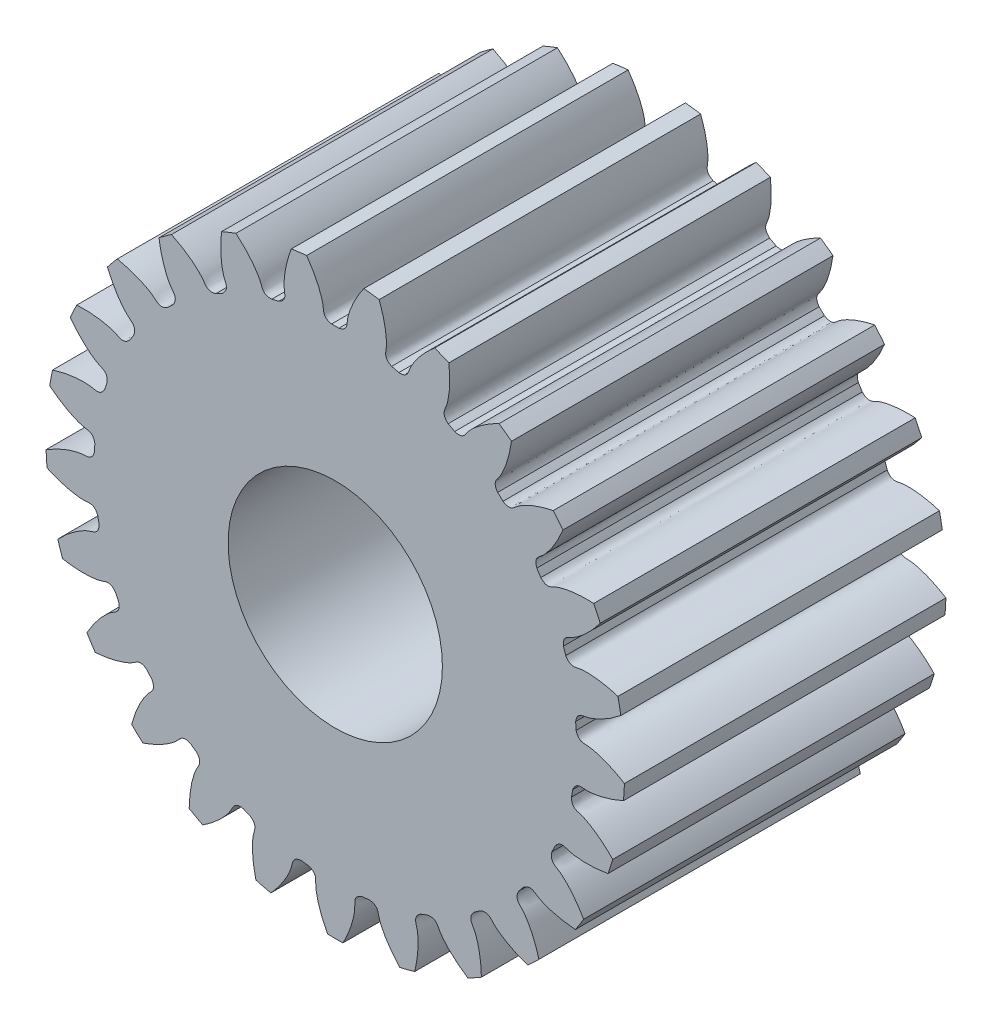
from build123d import *

# Parameters (mm, degrees)
SKETCH_1_R               = 2.7
EXTRUDE_1_DEPTH          = 3
CUT_EXTRUDE_1_DEPTH      = 5.855924217
PATTERN_CIRCULAR_1_COUNT = 25
SKETCH_4_R               = 1
CUT_EXTRUDE_2_DEPTH      = 5.854940348


with BuildPart() as part:
    # 草图1 → 凸台-拉伸1 (new body)
    with BuildSketch(Plane.XY):
        Circle(SKETCH_1_R)
    extrude(amount=EXTRUDE_1_DEPTH)

    # 草图2 → 切除-拉伸1 (cut, through all)
    with BuildSketch(Plane.XY):
        with BuildLine():
            ThreePointArc((0.034411698, 2.249736837), (0, 2.25), (-0.034411698, 2.249736837))
            add(Edge.make_bspline(
                [(-0.034411698, 2.249736837), (-0.114667963, 2.267016232), (-0.107101527, 2.315452279), (-0.114839077, 2.363610551), (-0.115924254, 2.369621688), (-0.117315286, 2.376531105), (-0.119047104, 2.38432889), (-0.121156157, 2.393003716), (-0.123677986, 2.402543279), (-0.126647969, 2.412934167), (-0.130101049, 2.42416191), (-0.134071779, 2.436210983), (-0.138594271, 2.449064816), (-0.143702179, 2.462705804), (-0.149428662, 2.477115321), (-0.155806365, 2.492273733), (-0.162867386, 2.508160411), (-0.170643252, 2.524753742), (-0.179164893, 2.54203115), (-0.188462612, 2.559969104), (-0.198566067, 2.578543142), (-0.209504238, 2.59772788), (-0.221305406, 2.617497035), (-0.23399713, 2.63782344), (-0.247606219, 2.658679063), (-0.262158711, 2.680035029), (-0.277679851, 2.701861634), (-0.294194065, 2.724128372), (-0.311724944, 2.74680395), (-0.330295214, 2.769856313), (-0.349926722, 2.793252666), (-0.370640414, 2.816959495), (-0.392456312, 2.84094259), (-0.4153935, 2.865167071), (-0.439470098, 2.889597408), (-0.464703252, 2.91419745), (-0.491109111, 2.938930447), (-0.518702812, 2.963759077), (-0.547498457, 2.988645472), (-0.587994789, 3.022253255), (-0.61949331, 3.046818631), (-0.641054295, 3.062966834)],
                knots=[0, 0, 0, 0, 0.130741207, 0.13574479, 0.141658115, 0.148481183, 0.156213993, 0.164856545, 0.174408839, 0.184870876, 0.196242655, 0.208524177, 0.221715441, 0.235816447, 0.250827195, 0.266747686, 0.283577919, 0.301317894, 0.319967612, 0.339527072, 0.359996274, 0.381375219, 0.403663906, 0.426862335, 0.450970507, 0.475988421, 0.501916077, 0.528753476, 0.556500617, 0.5851575, 0.614724126, 0.645200493, 0.676586604, 0.708882456, 0.742088051, 0.776203388, 0.811228468, 0.847163289, 0.884007854, 0.92176216, 1, 1, 1, 1], degree=3))
            ThreePointArc((-0.641054295, 3.062966834), (0, 3.129331628), (0.641054295, 3.062966834))
            add(Edge.make_bspline(
                [(0.034411698, 2.249736837), (0.114667963, 2.267016232), (0.107101527, 2.315452279), (0.114839077, 2.363610551), (0.115924254, 2.369621688), (0.117315286, 2.376531105), (0.119047104, 2.38432889), (0.121156157, 2.393003716), (0.123677986, 2.402543279), (0.126647969, 2.412934167), (0.130101049, 2.42416191), (0.134071779, 2.436210983), (0.138594271, 2.449064816), (0.143702179, 2.462705804), (0.149428662, 2.477115321), (0.155806365, 2.492273733), (0.162867386, 2.508160411), (0.170643252, 2.524753742), (0.179164893, 2.54203115), (0.188462612, 2.559969104), (0.198566067, 2.578543142), (0.209504238, 2.59772788), (0.221305406, 2.617497035), (0.23399713, 2.63782344), (0.247606219, 2.658679063), (0.262158711, 2.680035029), (0.277679851, 2.701861634), (0.294194065, 2.724128372), (0.311724944, 2.74680395), (0.330295214, 2.769856313), (0.349926722, 2.793252666), (0.370640414, 2.816959495), (0.392456312, 2.84094259), (0.4153935, 2.865167071), (0.439470098, 2.889597408), (0.464703252, 2.91419745), (0.491109111, 2.938930447), (0.518702812, 2.963759077), (0.547498457, 2.988645472), (0.587994789, 3.022253255), (0.61949331, 3.046818631), (0.641054295, 3.062966834)],
                knots=[0, 0, 0, 0, 0.130741207, 0.13574479, 0.141658115, 0.148481183, 0.156213993, 0.164856545, 0.174408839, 0.184870876, 0.196242655, 0.208524177, 0.221715441, 0.235816447, 0.250827195, 0.266747686, 0.283577919, 0.301317894, 0.319967612, 0.339527072, 0.359996274, 0.381375219, 0.403663906, 0.426862335, 0.450970507, 0.475988421, 0.501916077, 0.528753476, 0.556500617, 0.5851575, 0.614724126, 0.645200493, 0.676586604, 0.708882456, 0.742088051, 0.776203388, 0.811228468, 0.847163289, 0.884007854, 0.92176216, 1, 1, 1, 1], degree=3))
        make_face()
    cut_extrude_1 = extrude(amount=CUT_EXTRUDE_1_DEPTH, mode=Mode.SUBTRACT)

    # 阵列(圆周)1: 切除-拉伸1 ×25 about axis
    pattern_circular_1_axis = Axis((0, 0, 3), (0, 0, -1))
    for i in range(1, PATTERN_CIRCULAR_1_COUNT):
        add(cut_extrude_1.rotate(pattern_circular_1_axis, i * 360 / PATTERN_CIRCULAR_1_COUNT), mode=Mode.SUBTRACT)

    # 草图4 → 切除-拉伸2 (cut, through all)
    with BuildSketch(Plane.XY):
        Circle(SKETCH_4_R)
    extrude(amount=CUT_EXTRUDE_2_DEPTH, mode=Mode.SUBTRACT)


solid = part.part
